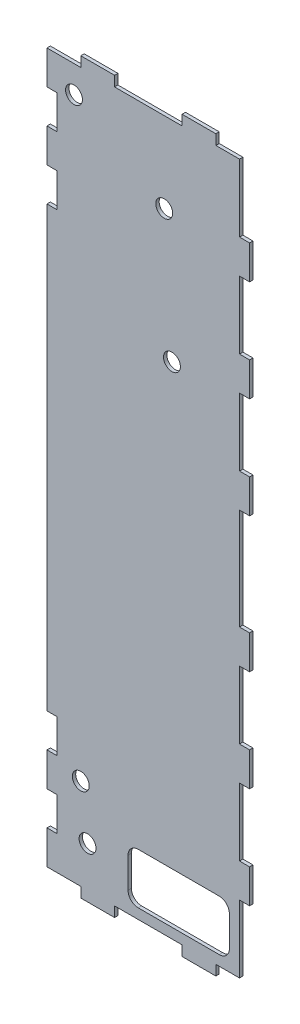
from build123d import *

# Parameters (mm, degrees)
SKETCH1_R           = 2.5
BOSS_EXTRUDE2_DEPTH = 1


with BuildPart() as part:
    # Sketch1 → Boss-Extrude2 (new body)
    with BuildSketch(Plane.XY):
        Polygon((3, 173), (0, 173), (0, 43), (3, 43), (3, 33), (0, 33), (0, 23), (3, 23), (3, 13), (0, 13), (0, 3), (10, 3), (10, 0), (20, 0), (20, 3), (40, 3), (40, 0), (50, 0), (50, 3), (57, 3), (57, 23), (60, 23), (60, 33), (57, 33), (57, 53), (60, 53), (60, 63), (57, 63), (57, 83), (60, 83), (60, 93), (57, 93), (57, 123), (60, 123), (60, 133), (57, 133), (57, 153), (60, 153), (60, 163), (57, 163), (57, 183), (60, 183), (60, 193), (57, 193), (57, 213), (50, 213), (50, 216), (40, 216), (40, 213), (20, 213), (20, 216), (10, 216), (10, 213), (0, 213), (0, 203), (3, 203), (3, 193), (0, 193), (0, 183), (3, 183), align=None)
        with Locations((12, 15)):
            Circle(SKETCH1_R, mode=Mode.SUBTRACT)
        with Locations((10, 30)):
            Circle(SKETCH1_R, mode=Mode.SUBTRACT)
        with BuildLine():
            ThreePointArc((24, 18), (24.878679656, 20.121320344), (27, 21))
            Line((27, 21), (51, 21))
            ThreePointArc((51, 21), (53.121320344, 20.121320344), (54, 18))
            Line((54, 18), (54, 9))
            ThreePointArc((54, 9), (53.121320344, 6.878679656), (51, 6))
            Line((51, 6), (27, 6))
            ThreePointArc((27, 6), (24.878679656, 6.878679656), (24, 9))
            Line((24, 9), (24, 18))
        make_face(mode=Mode.SUBTRACT)
        with Locations((8, 205)):
            Circle(SKETCH1_R, mode=Mode.SUBTRACT)
        with Locations((37, 151)):
            Circle(SKETCH1_R, mode=Mode.SUBTRACT)
        with Locations((34.713021846, 189.185576425)):
            Circle(SKETCH1_R, mode=Mode.SUBTRACT)
    extrude(amount=BOSS_EXTRUDE2_DEPTH)


solid = part.part
